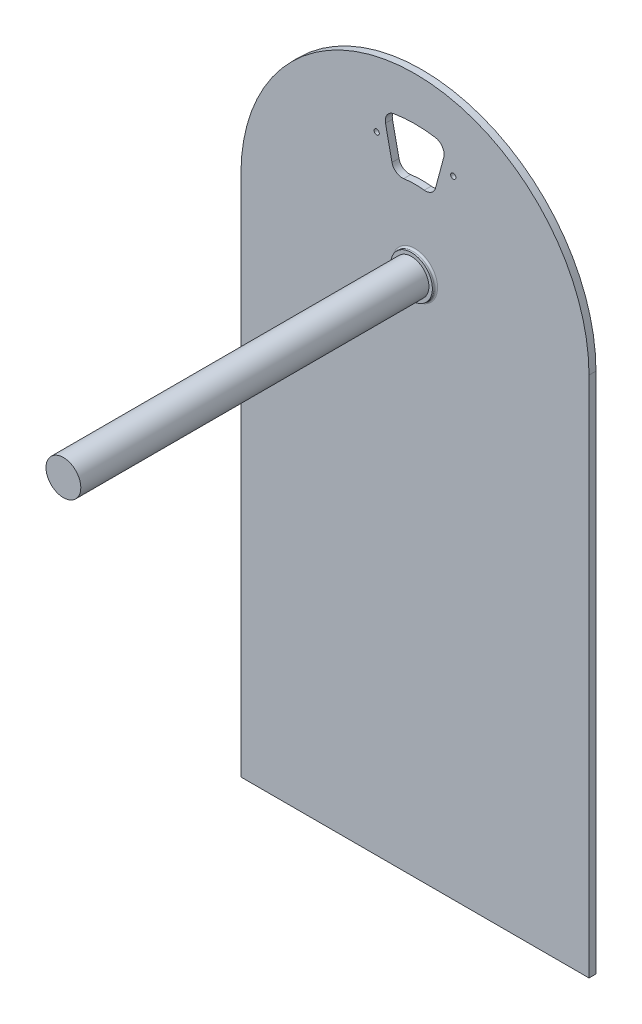
from build123d import *

# Parameters (mm, degrees)
SKETCH_1_R          = 50
EXTRUDE_1_DEPTH     = 2
SKETCH_2_R          = 6
EXTRUDE_2_DEPTH     = 1
SKETCH_3_R          = 5
EXTRUDE_3_DEPTH     = 100
FILLET_1_R          = 0.5
SKETCH_4_R          = 0.75
CUT_EXTRUDE_1_DEPTH = 10
SKETCH_5_W          = 100
SKETCH_5_H          = 150
EXTRUDE_4_DEPTH     = 2


with BuildPart() as part:
    # 草图1 → 凸台-拉伸1 (new body)
    with BuildSketch(Plane.XY):
        Circle(SKETCH_1_R)
        with BuildLine():
            Line((-8.46489845, 33.430105538), (-6.59071788, 24.612779199))
            ThreePointArc((-6.59071788, 24.612779199), (-5.371774848, 22.775404656), (-3.226125068, 22.267512592))
            ThreePointArc((-3.226125068, 22.267512592), (-0.282003378, 22.498232688), (2.666976337, 22.341379483))
            ThreePointArc((2.666976337, 22.341379483), (4.704329655, 22.835940411), (5.920350661, 24.543772946))
            Line((5.920350661, 24.543772946), (8.267408601, 33.303112428))
            ThreePointArc((8.267408601, 33.303112428), (7.884986755, 35.714496485), (5.836555568, 37.043010395))
            ThreePointArc((5.836555568, 37.043010395), (-0.088516087, 37.499895532), (-6.011364834, 37.015044142))
            ThreePointArc((-6.011364834, 37.015044142), (-8.006158275, 35.748212618), (-8.46489845, 33.430105538))
        make_face(mode=Mode.SUBTRACT)
    extrude(amount=EXTRUDE_1_DEPTH)

    # 草图2 → 凸台-拉伸2 (add)
    with BuildSketch(Plane.XY.offset(2)):
        Circle(SKETCH_2_R)
    extrude(amount=EXTRUDE_2_DEPTH)

    # 草图3 → 凸台-拉伸3 (add)
    with BuildSketch(Plane.XY.offset(3)):
        Circle(SKETCH_3_R)
    extrude(amount=EXTRUDE_3_DEPTH)

    # 圆角1
    fillet_1_edges = [part.edges().sort_by_distance(p)[0] for p in [
        (-6, 0, 2),
    ]]
    fillet(fillet_1_edges, radius=FILLET_1_R)

    # 草图4 → 切除-拉伸1 (cut)
    with BuildSketch(Plane(origin=(0, 0, 0), x_dir=(-1, 0, 0), z_dir=(0, 0, -1))):
        with Locations((-11, 30)):
            Circle(SKETCH_4_R)
        with Locations(Location((11, 30, 0), (0, 0, 180))):
            Circle(SKETCH_4_R)
    extrude(amount=-CUT_EXTRUDE_1_DEPTH, mode=Mode.SUBTRACT)

    # 草图5 → 凸台-拉伸4 (add)
    with BuildSketch(Plane.XY.offset(2)):
        with Locations((0, -75)):
            Rectangle(SKETCH_5_W, SKETCH_5_H)
    extrude(amount=-EXTRUDE_4_DEPTH)


solid = part.part
